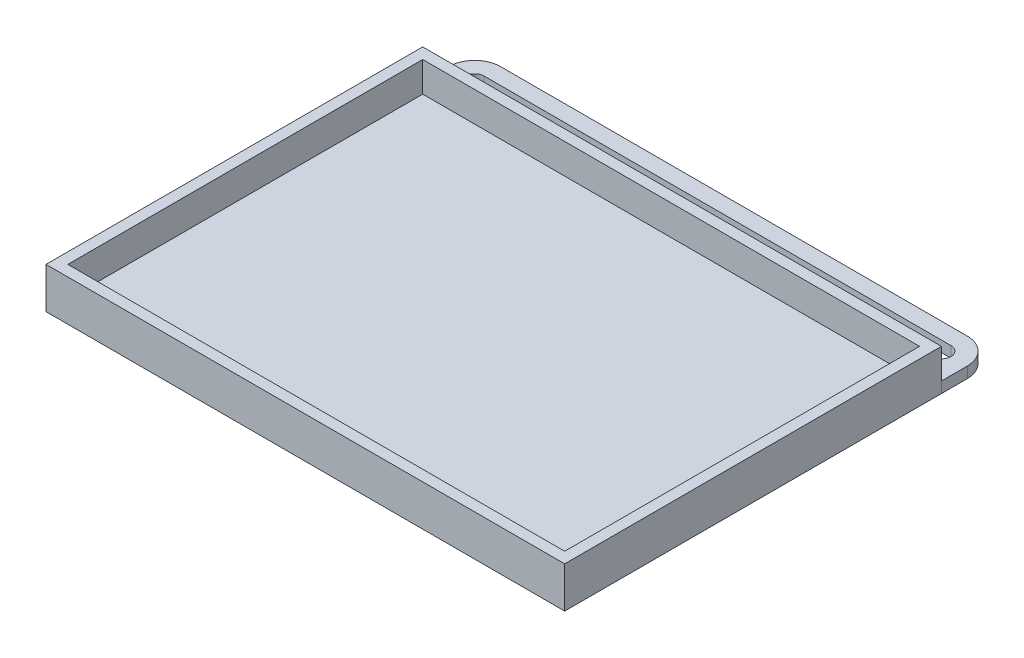
from build123d import *

# Parameters (mm, degrees)
CROQUIS2_W                   = 91
CROQUIS2_H                   = 65
SALIENTE_EXTRUIR1_DEPTH      = 2
CROQUIS3_W                   = 95
CROQUIS3_H                   = 69
CROQUIS3_W_2                 = 91
CROQUIS3_H_2                 = 65
SALIENTE_EXTRUIR2_DEPTH      = 5.5
SALIENTE_EXTRUIR3_DEPTH      = 2
CORTAR_EXTRUIR1_DEPTH        = 121.54667146
SALIENTE_EXTRUIR4_DEPTH      = 5.5
SALIENTE_EXTRUIR4_DEPTH_BACK = 2
CROQUIS3_2_W                 = 95
CROQUIS3_2_H                 = 69
CROQUIS3_2_W_2               = 91
CROQUIS3_2_H_2               = 65


with BuildPart() as part:
    # Croquis2 → Saliente-Extruir1 (new body)
    with BuildSketch(Plane(origin=(0, 0, 0), x_dir=(1, 0, 0), z_dir=(0, 1, 0))):
        with Locations((45.5, 32.5)):
            Rectangle(CROQUIS2_W, CROQUIS2_H)
    extrude(amount=SALIENTE_EXTRUIR1_DEPTH)

    # Croquis6 → Cortar-Extruir1 (cut, through all)
    with BuildSketch(Plane(origin=(0, 2, 0), x_dir=(1, 0, 0), z_dir=(0, 1, 0))):
        with BuildLine():
            Line((25.5, 0), (65.5, 0))
            Line((65.5, 0), (65.5, 1))
            ThreePointArc((65.5, 1), (64.914213562, 2.414213562), (63.5, 3))
            Line((63.5, 3), (27.5, 3))
            ThreePointArc((27.5, 3), (26.085786438, 2.414213562), (25.5, 1))
            Line((25.5, 1), (25.5, 0))
        make_face()
    extrude(amount=-CORTAR_EXTRUIR1_DEPTH, mode=Mode.SUBTRACT)


with BuildPart() as body_2:
    # Croquis3 → Saliente-Extruir2 (new body)
    with BuildSketch(Plane(origin=(0, 2, 0), x_dir=(1, 0, 0), z_dir=(0, 1, 0))):
        with Locations((45.5, 32.5)):
            Rectangle(CROQUIS3_W, CROQUIS3_H)
        with Locations((45.5, 32.5)):
            Rectangle(CROQUIS3_W_2, CROQUIS3_H_2, mode=Mode.SUBTRACT)
    extrude(amount=SALIENTE_EXTRUIR2_DEPTH)


    add(part.part)  # Saliente-Extruir4 merges part
    # Croquis3<2> → Saliente-Extruir4 (add, two sides: drawn at the far end of the back side and taken through both)
    with BuildSketch(Plane(origin=(0, 2, 0), x_dir=(1, 0, 0), z_dir=(0, 1, 0)).offset(-SALIENTE_EXTRUIR4_DEPTH_BACK)):
        with Locations((45.5, 32.5)):
            Rectangle(CROQUIS3_2_W, CROQUIS3_2_H)
        with Locations((45.5, 32.5)):
            Rectangle(CROQUIS3_2_W_2, CROQUIS3_2_H_2, mode=Mode.SUBTRACT)
    extrude(amount=SALIENTE_EXTRUIR4_DEPTH + SALIENTE_EXTRUIR4_DEPTH_BACK)


with BuildPart() as body_3:
    # Croquis5 → Saliente-Extruir3 (new body)
    with BuildSketch(Plane(origin=(0, 2, 0), x_dir=(1, 0, 0), z_dir=(0, 1, 0))):
        with BuildLine():
            Line((88.25, 76.5), (2.75, 76.5))
            ThreePointArc((2.75, 76.5), (-0.608757211, 75.108757211), (-2, 71.75))
            Line((-2, 71.75), (-2, 67))
            Line((-2, 67), (93, 67))
            Line((93, 67), (93, 71.75))
            ThreePointArc((93, 71.75), (91.608757211, 75.108757211), (88.25, 76.5))
        make_face()
        with BuildLine():
            ThreePointArc((2.75, 70), (1, 71.75), (2.75, 73.5))
            Line((2.75, 73.5), (88.25, 73.5))
            ThreePointArc((88.25, 73.5), (90, 71.75), (88.25, 70))
            Line((88.25, 70), (2.75, 70))
        make_face(mode=Mode.SUBTRACT)
    extrude(amount=-SALIENTE_EXTRUIR3_DEPTH)


solid = Compound([body_2.part, body_3.part])
